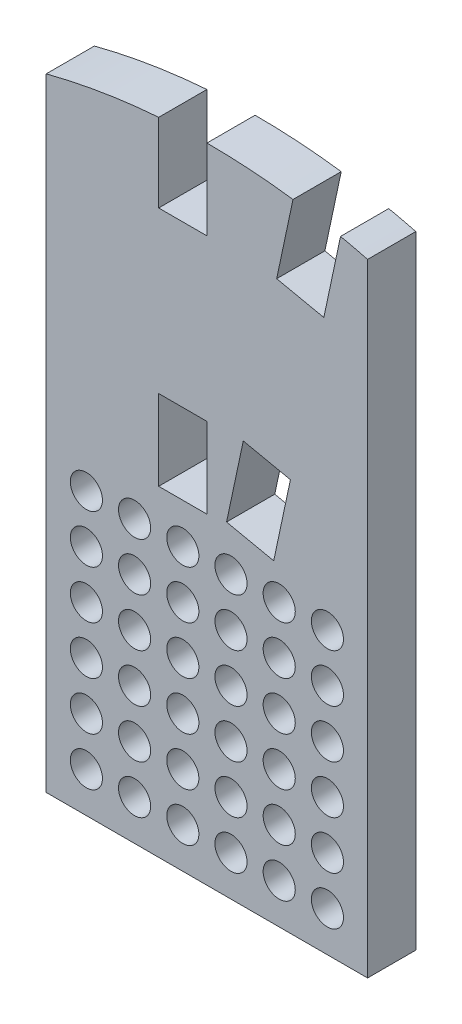
from build123d import *

# Parameters (mm, degrees)
SKETCH1_R           = 1
SKETCH1_W           = 3
SKETCH1_H           = 5
BOSS_EXTRUDE1_DEPTH = 3


with BuildPart() as part:
    # Sketch1 → Boss-Extrude1 (new body)
    with BuildSketch(Plane.XY):
        with BuildLine():
            ThreePointArc((20, 38.729833462), (19.160374698, 38.936968749), (18.316467633, 39.125904029))
            Line((18.316467633, 39.125904029), (17.276909179, 34.235166026))
            Line((17.276909179, 34.235166026), (14.342466376, 34.858901098))
            Line((14.342466376, 34.858901098), (15.35860178, 39.639442314))
            ThreePointArc((15.35860178, 39.639442314), (12.685359142, 39.909758785), (10, 40))
            Line((10, 40), (10, 35))
            Line((10, 35), (7, 35))
            Line((7, 35), (7, 39.88734135))
            ThreePointArc((7, 39.88734135), (3.47428501, 39.464098164), (0, 38.729833462))
            Line((0, 38.729833462), (0, 0))
            Line((0, 0), (20, 0))
            Line((20, 0), (20, 38.729833462))
        make_face()
        with Locations((2.5, 2.5)):
            Circle(SKETCH1_R, mode=Mode.SUBTRACT)
        with Locations((2.5, 5.5)):
            Circle(SKETCH1_R, mode=Mode.SUBTRACT)
        with Locations((2.5, 8.5)):
            Circle(SKETCH1_R, mode=Mode.SUBTRACT)
        with Locations((5.5, 2.5)):
            Circle(SKETCH1_R, mode=Mode.SUBTRACT)
        with Locations((8.5, 2.5)):
            Circle(SKETCH1_R, mode=Mode.SUBTRACT)
        with Locations((5.5, 5.5)):
            Circle(SKETCH1_R, mode=Mode.SUBTRACT)
        with Locations((5.5, 8.5)):
            Circle(SKETCH1_R, mode=Mode.SUBTRACT)
        with Locations((8.5, 5.5)):
            Circle(SKETCH1_R, mode=Mode.SUBTRACT)
        with Locations((8.5, 8.5)):
            Circle(SKETCH1_R, mode=Mode.SUBTRACT)
        with Locations((2.5, 11.5)):
            Circle(SKETCH1_R, mode=Mode.SUBTRACT)
        with Locations((2.5, 14.5)):
            Circle(SKETCH1_R, mode=Mode.SUBTRACT)
        with Locations((2.5, 17.5)):
            Circle(SKETCH1_R, mode=Mode.SUBTRACT)
        with Locations((5.5, 11.5)):
            Circle(SKETCH1_R, mode=Mode.SUBTRACT)
        with Locations((5.5, 14.5)):
            Circle(SKETCH1_R, mode=Mode.SUBTRACT)
        with Locations((8.5, 11.5)):
            Circle(SKETCH1_R, mode=Mode.SUBTRACT)
        with Locations((8.5, 14.5)):
            Circle(SKETCH1_R, mode=Mode.SUBTRACT)
        with Locations((5.5, 17.5)):
            Circle(SKETCH1_R, mode=Mode.SUBTRACT)
        with Locations((8.5, 17.5)):
            Circle(SKETCH1_R, mode=Mode.SUBTRACT)
        with Locations((11.5, 2.5)):
            Circle(SKETCH1_R, mode=Mode.SUBTRACT)
        with Locations((14.5, 2.5)):
            Circle(SKETCH1_R, mode=Mode.SUBTRACT)
        with Locations((11.5, 5.5)):
            Circle(SKETCH1_R, mode=Mode.SUBTRACT)
        with Locations((11.5, 8.5)):
            Circle(SKETCH1_R, mode=Mode.SUBTRACT)
        with Locations((14.5, 5.5)):
            Circle(SKETCH1_R, mode=Mode.SUBTRACT)
        with Locations((14.5, 8.5)):
            Circle(SKETCH1_R, mode=Mode.SUBTRACT)
        with Locations((17.5, 2.5)):
            Circle(SKETCH1_R, mode=Mode.SUBTRACT)
        with Locations((17.5, 5.5)):
            Circle(SKETCH1_R, mode=Mode.SUBTRACT)
        with Locations((17.5, 8.5)):
            Circle(SKETCH1_R, mode=Mode.SUBTRACT)
        with Locations((11.5, 11.5)):
            Circle(SKETCH1_R, mode=Mode.SUBTRACT)
        with Locations((11.5, 14.5)):
            Circle(SKETCH1_R, mode=Mode.SUBTRACT)
        with Locations((14.5, 11.5)):
            Circle(SKETCH1_R, mode=Mode.SUBTRACT)
        with Locations((14.5, 14.5)):
            Circle(SKETCH1_R, mode=Mode.SUBTRACT)
        with Locations((11.5, 17.5)):
            Circle(SKETCH1_R, mode=Mode.SUBTRACT)
        with Locations((14.5, 17.5)):
            Circle(SKETCH1_R, mode=Mode.SUBTRACT)
        with Locations((17.5, 11.5)):
            Circle(SKETCH1_R, mode=Mode.SUBTRACT)
        with Locations((17.5, 14.5)):
            Circle(SKETCH1_R, mode=Mode.SUBTRACT)
        with Locations((17.5, 17.5)):
            Circle(SKETCH1_R, mode=Mode.SUBTRACT)
        with Locations((8.5, 22.5)):
            Rectangle(SKETCH1_W, SKETCH1_H, mode=Mode.SUBTRACT)
        Polygon((15.19779227, 24.453690018), (14.158233816, 19.562952015), (11.223791014, 20.186687087), (12.263349468, 25.077425091), align=None, mode=Mode.SUBTRACT)
    extrude(amount=BOSS_EXTRUDE1_DEPTH)


solid = part.part
